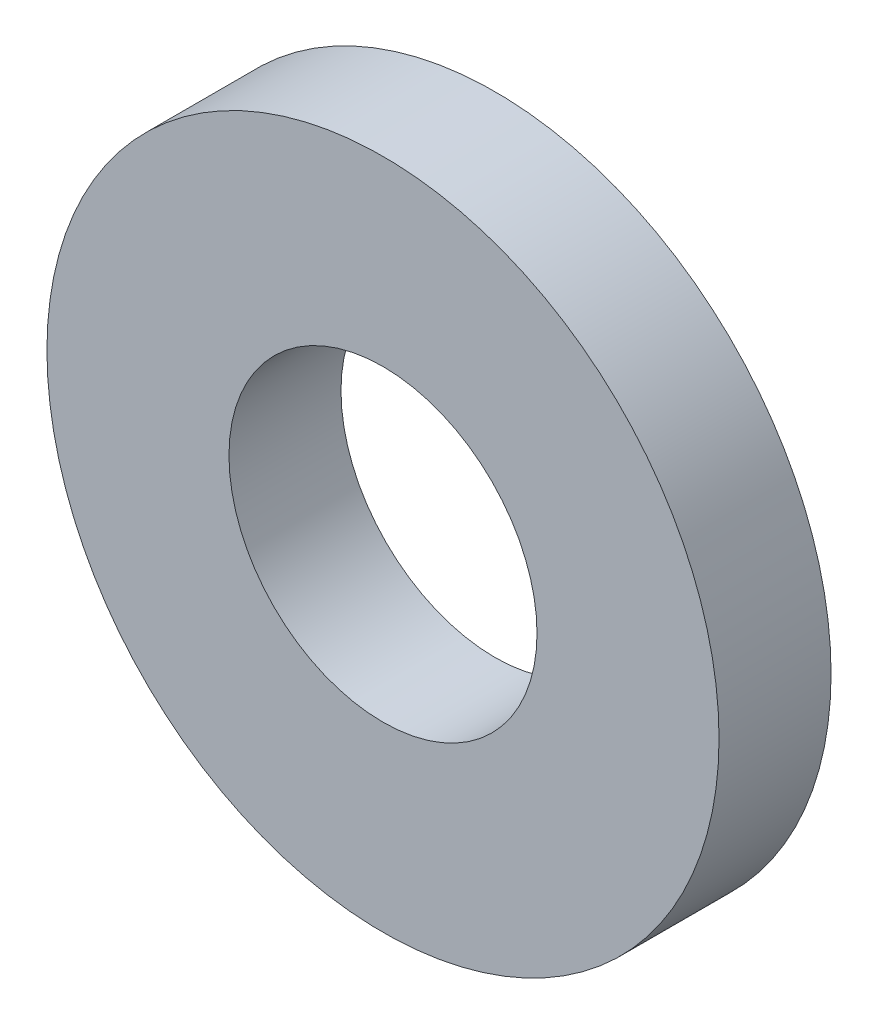
from build123d import *

# Parameters (mm, degrees)
SKETCH_1_R      = 6
SKETCH_1_R_2    = 2.75
EXTRUDE_1_DEPTH = 2


with BuildPart() as part:
    # Эскиз1 → Бобышка-Вытянуть1 (new body)
    with BuildSketch(Plane.XY):
        Circle(SKETCH_1_R)
        Circle(SKETCH_1_R_2, mode=Mode.SUBTRACT)
    extrude(amount=EXTRUDE_1_DEPTH)


solid = part.part
